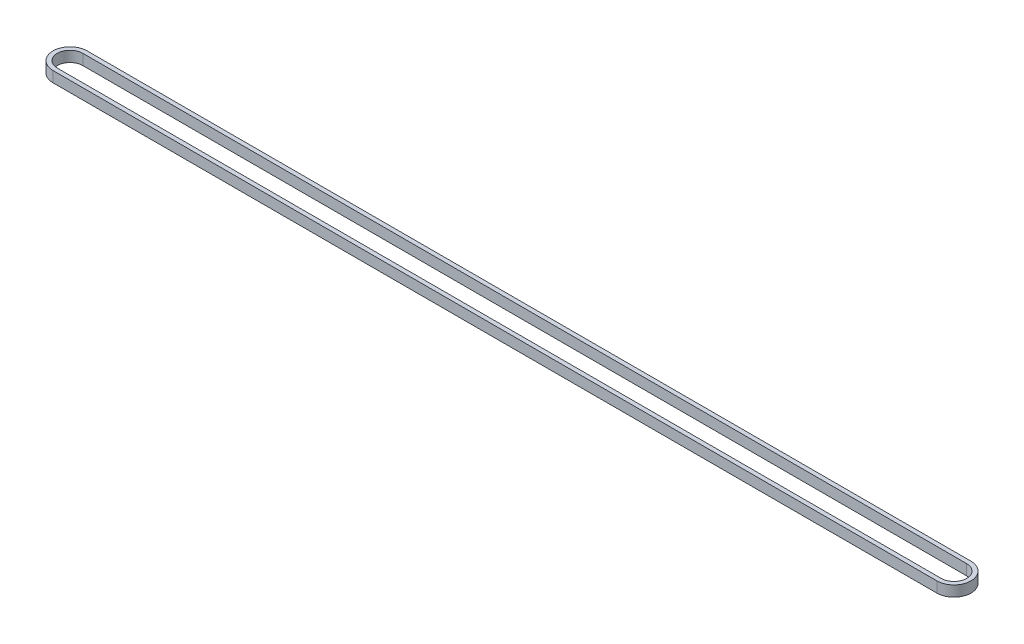
from build123d import *

# Parameters (mm, degrees)
BOSS_EXTRUDE1_DEPTH = 5


with BuildPart() as part:
    # Sketch2 → Boss-Extrude1 (new body)
    with BuildSketch(Plane(origin=(0, 0, 0), x_dir=(1, 0, 0), z_dir=(0, 1, 0))):
        with BuildLine():
            Line((39.267874126, 73.022465677), (454.267874126, 73.022465677))
            ThreePointArc((454.267874126, 73.022465677), (462.267874126, 65.022465677), (454.267874126, 57.022465677))
            Line((454.267874126, 57.022465677), (39.267874126, 57.022465677))
            ThreePointArc((39.267874126, 57.022465677), (31.267874126, 65.022465677), (39.267874126, 73.022465677))
        make_face()
        with BuildLine():
            Line((39.267874126, 71.022465677), (454.267874126, 71.022465677))
            ThreePointArc((454.267874126, 71.022465677), (460.267874126, 65.022465677), (454.267874126, 59.022465677))
            Line((454.267874126, 59.022465677), (39.267874126, 59.022465677))
            ThreePointArc((39.267874126, 59.022465677), (33.267874126, 65.022465677), (39.267874126, 71.022465677))
        make_face(mode=Mode.SUBTRACT)
    extrude(amount=BOSS_EXTRUDE1_DEPTH)


solid = part.part
